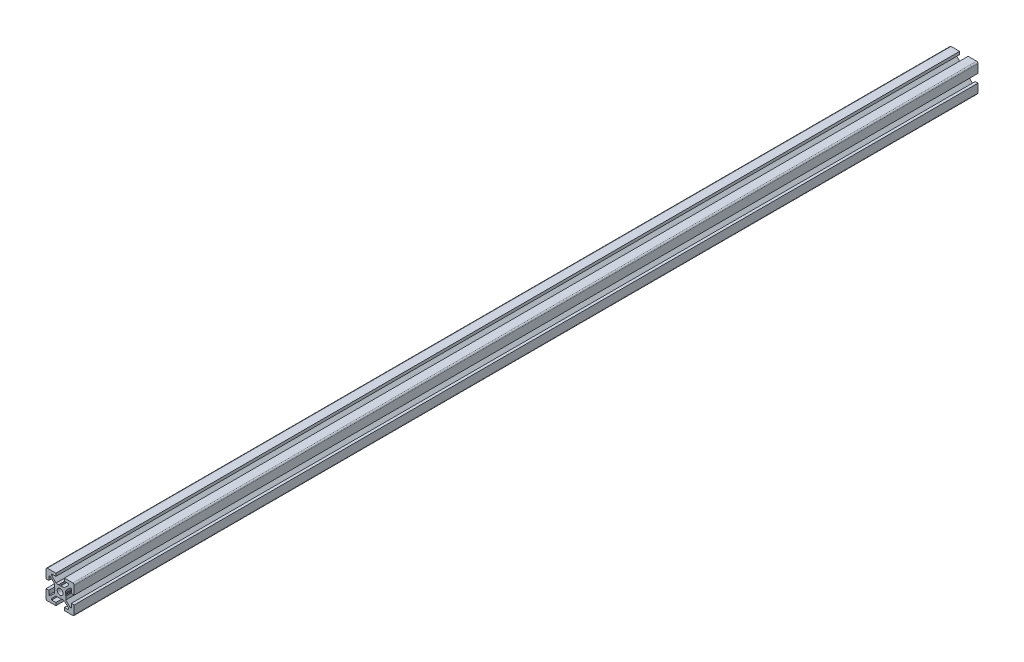
from build123d import *

# Parameters (mm, degrees)
SKETCH1_R           = 2.1
BOSS_EXTRUDE1_DEPTH = 640


with BuildPart() as part:
    # Sketch1 → Boss-Extrude1 (new body)
    with BuildSketch(Plane(origin=(0, 0, -2000), x_dir=(-1, 0, 0), z_dir=(0, 0, -1))):
        with BuildLine():
            Line((10, -3), (8, -3))
            Line((8, -3), (8, -6))
            Line((8, -6), (7.060660172, -6))
            Line((7.060660172, -6), (4, -2.939339828))
            Line((4, -2.939339828), (4, -2.5))
            Line((4, -2.5), (3.750976592, -1.218885629))
            Line((3.750976592, -1.218885629), (3.933012702, -0.903589838))
            ThreePointArc((3.933012702, -0.903589838), (4, -0.653589838), (3.933012702, -0.403589838))
            Line((3.933012702, -0.403589838), (3.7, 0))
            Line((3.7, 0), (3.933012702, 0.403589838))
            ThreePointArc((3.933012702, 0.403589838), (3.982962913, 0.524180316), (4, 0.653589838))
            Line((4, 0.653589838), (4, 2.939339828))
            Line((4, 2.939339828), (7.060660172, 6))
            Line((7.060660172, 6), (8, 6))
            Line((8, 6), (8, 3))
            Line((8, 3), (10, 3))
            Line((10, 3), (10, 9))
            ThreePointArc((10, 9), (9.707106781, 9.707106781), (9, 10))
            Line((9, 10), (3, 10))
            Line((3, 10), (3, 8))
            Line((3, 8), (6, 8))
            Line((6, 8), (6, 7.060660172))
            Line((6, 7.060660172), (2.939339828, 4))
            Line((2.939339828, 4), (2.5, 4))
            Line((2.5, 4), (1.218885629, 3.750976592))
            Line((1.218885629, 3.750976592), (0.903589838, 3.933012702))
            ThreePointArc((0.903589838, 3.933012702), (0.653589838, 4), (0.403589838, 3.933012702))
            Line((0.403589838, 3.933012702), (0, 3.7))
            Line((0, 3.7), (-0.403589838, 3.933012702))
            ThreePointArc((-0.403589838, 3.933012702), (-0.524180316, 3.982962913), (-0.653589838, 4))
            Line((-0.653589838, 4), (-2.939339828, 4))
            Line((-2.939339828, 4), (-6, 7.060660172))
            Line((-6, 7.060660172), (-6, 8))
            Line((-6, 8), (-3, 8))
            Line((-3, 8), (-3, 10))
            Line((-3, 10), (-9, 10))
            ThreePointArc((-9, 10), (-9.707106781, 9.707106781), (-10, 9))
            Line((-10, 9), (-10, 3))
            Line((-10, 3), (-8, 3))
            Line((-8, 3), (-8, 6))
            Line((-8, 6), (-7.060660172, 6))
            Line((-7.060660172, 6), (-4, 2.939339828))
            Line((-4, 2.939339828), (-4, 2.5))
            Line((-4, 2.5), (-3.750976592, 1.218885629))
            Line((-3.750976592, 1.218885629), (-3.933012702, 0.903589838))
            ThreePointArc((-3.933012702, 0.903589838), (-4, 0.653589838), (-3.933012702, 0.403589838))
            Line((-3.933012702, 0.403589838), (-3.7, 0))
            Line((-3.7, 0), (-3.933012702, -0.403589838))
            ThreePointArc((-3.933012702, -0.403589838), (-3.982962913, -0.524180316), (-4, -0.653589838))
            Line((-4, -0.653589838), (-4, -2.939339828))
            Line((-4, -2.939339828), (-7.060660172, -6))
            Line((-7.060660172, -6), (-8, -6))
            Line((-8, -6), (-8, -3))
            Line((-8, -3), (-10, -3))
            Line((-10, -3), (-10, -9))
            ThreePointArc((-10, -9), (-9.707106781, -9.707106781), (-9, -10))
            Line((-9, -10), (-3, -10))
            Line((-3, -10), (-3, -8))
            Line((-3, -8), (-6, -8))
            Line((-6, -8), (-6, -7.060660172))
            Line((-6, -7.060660172), (-2.939339828, -4))
            Line((-2.939339828, -4), (-2.5, -4))
            Line((-2.5, -4), (-1.218885629, -3.750976592))
            Line((-1.218885629, -3.750976592), (-0.903589838, -3.933012702))
            ThreePointArc((-0.903589838, -3.933012702), (-0.653589838, -4), (-0.403589838, -3.933012702))
            Line((-0.403589838, -3.933012702), (0, -3.7))
            Line((0, -3.7), (0.403589838, -3.933012702))
            ThreePointArc((0.403589838, -3.933012702), (0.524180316, -3.982962913), (0.653589838, -4))
            Line((0.653589838, -4), (2.939339828, -4))
            Line((2.939339828, -4), (6, -7.060660172))
            Line((6, -7.060660172), (6, -8))
            Line((6, -8), (3, -8))
            Line((3, -8), (3, -10))
            Line((3, -10), (9, -10))
            ThreePointArc((9, -10), (9.707106781, -9.707106781), (10, -9))
            Line((10, -9), (10, -3))
        make_face()
        with Locations(Location((0, 0, 0), (0, 0, 180))):
            Circle(SKETCH1_R, mode=Mode.SUBTRACT)
    extrude(amount=-BOSS_EXTRUDE1_DEPTH)


solid = part.part
